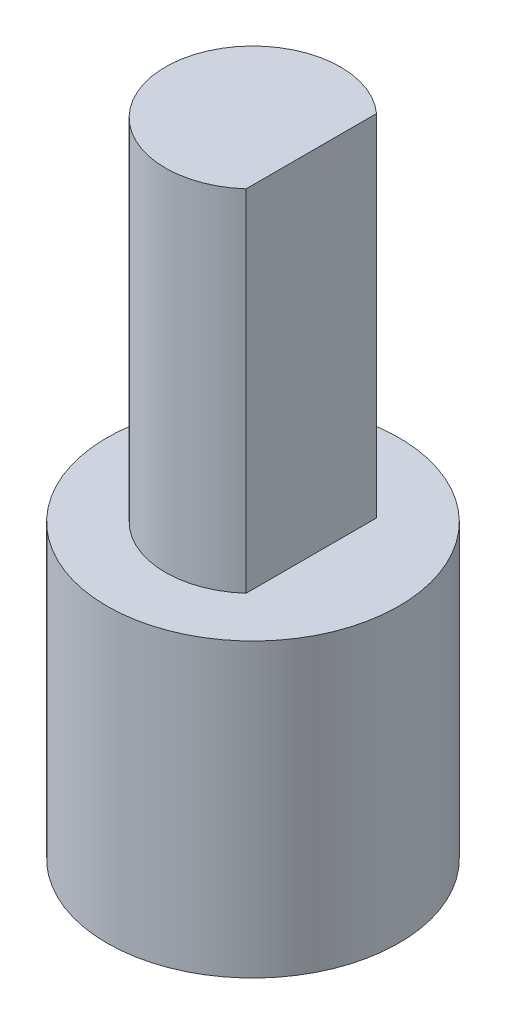
from build123d import *

# Parameters (mm, degrees)
SKETCH_1_R      = 2.5
EXTRUDE_1_DEPTH = 5
EXTRUDE_2_DEPTH = 6


with BuildPart() as part:
    # 草图1 → 凸台-拉伸1 (new body)
    with BuildSketch(Plane(origin=(0, 0, 0), x_dir=(1, 0, 0), z_dir=(0, 1, 0))):
        with Locations(Location((0, 0, 0), (0, 0, 270))):
            Circle(SKETCH_1_R)
    extrude(amount=EXTRUDE_1_DEPTH)

    # 草图2 → 凸台-拉伸2 (add)
    with BuildSketch(Plane(origin=(0, 5, 0), x_dir=(1, 0, 0), z_dir=(0, 1, 0))):
        with BuildLine():
            Line((1, 1.118033989), (1, -1.118033989))
            ThreePointArc((1, -1.118033989), (-1.5, 0), (1, 1.118033989))
        make_face()
    extrude(amount=EXTRUDE_2_DEPTH)


solid = part.part
